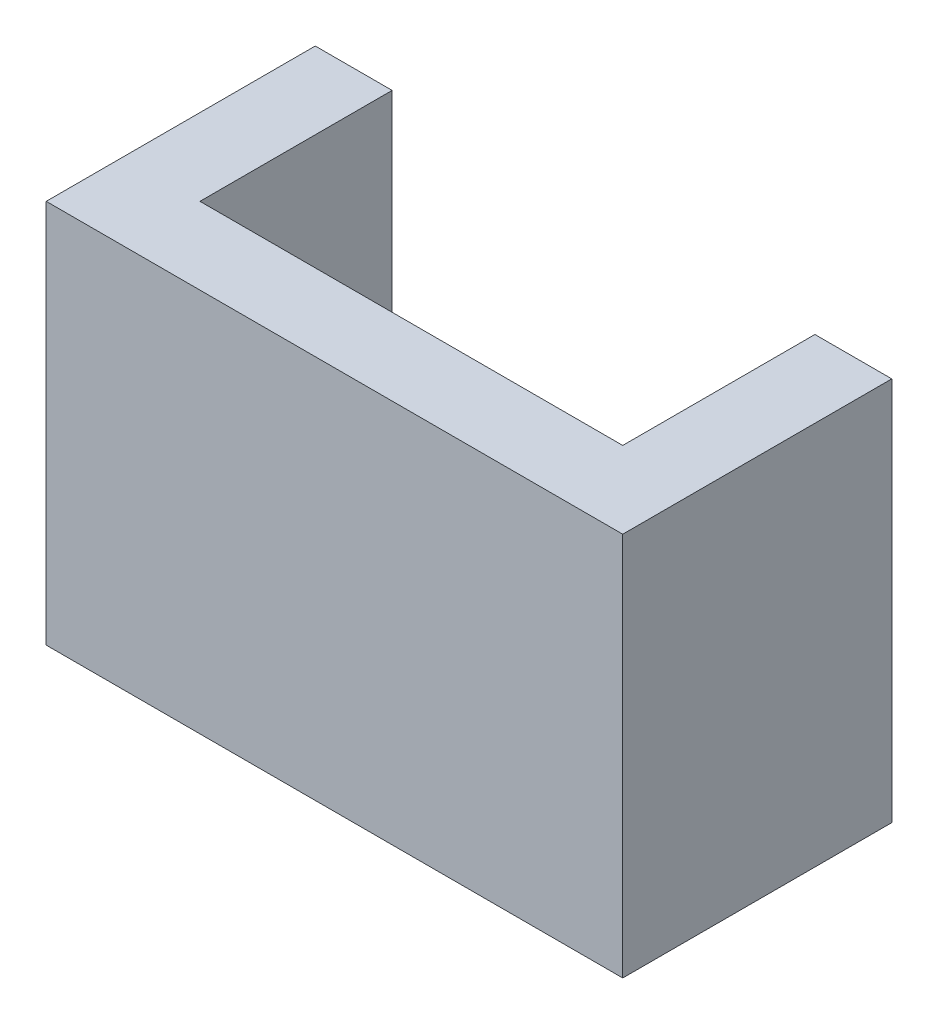
from build123d import *

# Parameters (mm, degrees)
SKETCH1_W           = 15
SKETCH1_H           = 10
BOSS_EXTRUDE1_DEPTH = 7
SKETCH2_W           = 11
SKETCH2_H           = 5
CUT_EXTRUDE1_DEPTH  = 10


with BuildPart() as part:
    # Sketch1 → Boss-Extrude1 (new body)
    with BuildSketch(Plane.XY):
        with Locations((0.322195704, -1.079952267)):
            Rectangle(SKETCH1_W, SKETCH1_H)
    extrude(amount=BOSS_EXTRUDE1_DEPTH)

    # Sketch2 → Cut-Extrude1 (cut)
    with BuildSketch(Plane(origin=(0, 3.920047733, 0), x_dir=(1, 0, 0), z_dir=(0, 1, 0))):
        with Locations((0.322195704, -2.5)):
            Rectangle(SKETCH2_W, SKETCH2_H)
    extrude(amount=-CUT_EXTRUDE1_DEPTH, mode=Mode.SUBTRACT)


solid = part.part
